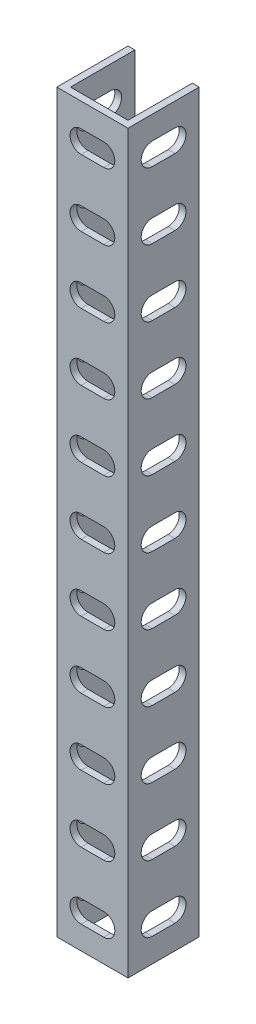
from build123d import *

# Parameters (mm, degrees)
SKETCH1_W           = 13.54
SKETCH1_H           = 140
BOSS_EXTRUDE1_DEPTH = 1.3
SKETCH5_W           = 13.54
SKETCH5_H           = 140
BOSS_EXTRUDE2_DEPTH = 1.3


with BuildPart() as part:
    # Sketch1 → Boss-Extrude1 (new body)
    with BuildSketch(Plane.XY):
        with Locations((0, -63.33)):
            Rectangle(SKETCH1_W, SKETCH1_H)
        with BuildLine():
            Line((-2.15, 2.11), (2.15, 2.11))
            ThreePointArc((2.15, 2.11), (4.26, 0), (2.15, -2.11))
            Line((2.15, -2.11), (-2.15, -2.11))
            ThreePointArc((-2.15, -2.11), (-4.26, 0), (-2.15, 2.11))
        make_face(mode=Mode.SUBTRACT)
        with BuildLine():
            Line((-2.15, -10.57), (2.15, -10.57))
            ThreePointArc((2.15, -10.57), (4.26, -12.68), (2.15, -14.79))
            Line((2.15, -14.79), (-2.15, -14.79))
            ThreePointArc((-2.15, -14.79), (-4.26, -12.68), (-2.15, -10.57))
        make_face(mode=Mode.SUBTRACT)
        with BuildLine():
            Line((-2.15, -23.25), (2.15, -23.25))
            ThreePointArc((2.15, -23.25), (4.26, -25.36), (2.15, -27.47))
            Line((2.15, -27.47), (-2.15, -27.47))
            ThreePointArc((-2.15, -27.47), (-4.26, -25.36), (-2.15, -23.25))
        make_face(mode=Mode.SUBTRACT)
        with BuildLine():
            Line((-2.15, -35.93), (2.15, -35.93))
            ThreePointArc((2.15, -35.93), (4.26, -38.04), (2.15, -40.15))
            Line((2.15, -40.15), (-2.15, -40.15))
            ThreePointArc((-2.15, -40.15), (-4.26, -38.04), (-2.15, -35.93))
        make_face(mode=Mode.SUBTRACT)
        with BuildLine():
            Line((-2.15, -48.61), (2.15, -48.61))
            ThreePointArc((2.15, -48.61), (4.26, -50.72), (2.15, -52.83))
            Line((2.15, -52.83), (-2.15, -52.83))
            ThreePointArc((-2.15, -52.83), (-4.26, -50.72), (-2.15, -48.61))
        make_face(mode=Mode.SUBTRACT)
        with BuildLine():
            Line((-2.15, -61.29), (2.15, -61.29))
            ThreePointArc((2.15, -61.29), (4.26, -63.4), (2.15, -65.51))
            Line((2.15, -65.51), (-2.15, -65.51))
            ThreePointArc((-2.15, -65.51), (-4.26, -63.4), (-2.15, -61.29))
        make_face(mode=Mode.SUBTRACT)
        with BuildLine():
            Line((-2.15, -73.97), (2.15, -73.97))
            ThreePointArc((2.15, -73.97), (4.26, -76.08), (2.15, -78.19))
            Line((2.15, -78.19), (-2.15, -78.19))
            ThreePointArc((-2.15, -78.19), (-4.26, -76.08), (-2.15, -73.97))
        make_face(mode=Mode.SUBTRACT)
        with BuildLine():
            Line((-2.15, -86.65), (2.15, -86.65))
            ThreePointArc((2.15, -86.65), (4.26, -88.76), (2.15, -90.87))
            Line((2.15, -90.87), (-2.15, -90.87))
            ThreePointArc((-2.15, -90.87), (-4.26, -88.76), (-2.15, -86.65))
        make_face(mode=Mode.SUBTRACT)
        with BuildLine():
            Line((-2.15, -99.33), (2.15, -99.33))
            ThreePointArc((2.15, -99.33), (4.26, -101.44), (2.15, -103.55))
            Line((2.15, -103.55), (-2.15, -103.55))
            ThreePointArc((-2.15, -103.55), (-4.26, -101.44), (-2.15, -99.33))
        make_face(mode=Mode.SUBTRACT)
        with BuildLine():
            Line((-2.15, -112.01), (2.15, -112.01))
            ThreePointArc((2.15, -112.01), (4.26, -114.12), (2.15, -116.23))
            Line((2.15, -116.23), (-2.15, -116.23))
            ThreePointArc((-2.15, -116.23), (-4.26, -114.12), (-2.15, -112.01))
        make_face(mode=Mode.SUBTRACT)
        with BuildLine():
            Line((-2.15, -124.69), (2.15, -124.69))
            ThreePointArc((2.15, -124.69), (4.26, -126.8), (2.15, -128.91))
            Line((2.15, -128.91), (-2.15, -128.91))
            ThreePointArc((-2.15, -128.91), (-4.26, -126.8), (-2.15, -124.69))
        make_face(mode=Mode.SUBTRACT)
    extrude(amount=-BOSS_EXTRUDE1_DEPTH)

    # Sketch5 → Boss-Extrude2 (add)
    with BuildSketch(Plane(origin=(6.77, 0, 0), x_dir=(0, 0, -1), z_dir=(1, 0, 0))):
        with Locations((6.77, -63.33)):
            Rectangle(SKETCH5_W, SKETCH5_H)
        with BuildLine():
            Line((4.62, 2.25), (8.92, 2.25))
            ThreePointArc((8.92, 2.25), (11.03, 0.14), (8.92, -1.97))
            Line((8.92, -1.97), (4.62, -1.97))
            ThreePointArc((4.62, -1.97), (2.51, 0.14), (4.62, 2.25))
        make_face(mode=Mode.SUBTRACT)
        with BuildLine():
            Line((4.62, -10.43), (8.92, -10.43))
            ThreePointArc((8.92, -10.43), (11.03, -12.54), (8.92, -14.65))
            Line((8.92, -14.65), (4.62, -14.65))
            ThreePointArc((4.62, -14.65), (2.51, -12.54), (4.62, -10.43))
        make_face(mode=Mode.SUBTRACT)
        with BuildLine():
            Line((4.62, -23.11), (8.92, -23.11))
            ThreePointArc((8.92, -23.11), (11.03, -25.22), (8.92, -27.33))
            Line((8.92, -27.33), (4.62, -27.33))
            ThreePointArc((4.62, -27.33), (2.51, -25.22), (4.62, -23.11))
        make_face(mode=Mode.SUBTRACT)
        with BuildLine():
            Line((4.62, -35.79), (8.92, -35.79))
            ThreePointArc((8.92, -35.79), (11.03, -37.9), (8.92, -40.01))
            Line((8.92, -40.01), (4.62, -40.01))
            ThreePointArc((4.62, -40.01), (2.51, -37.9), (4.62, -35.79))
        make_face(mode=Mode.SUBTRACT)
        with BuildLine():
            Line((4.62, -48.47), (8.92, -48.47))
            ThreePointArc((8.92, -48.47), (11.03, -50.58), (8.92, -52.69))
            Line((8.92, -52.69), (4.62, -52.69))
            ThreePointArc((4.62, -52.69), (2.51, -50.58), (4.62, -48.47))
        make_face(mode=Mode.SUBTRACT)
        with BuildLine():
            Line((4.62, -61.15), (8.92, -61.15))
            ThreePointArc((8.92, -61.15), (11.03, -63.26), (8.92, -65.37))
            Line((8.92, -65.37), (4.62, -65.37))
            ThreePointArc((4.62, -65.37), (2.51, -63.26), (4.62, -61.15))
        make_face(mode=Mode.SUBTRACT)
        with BuildLine():
            Line((4.62, -73.83), (8.92, -73.83))
            ThreePointArc((8.92, -73.83), (11.03, -75.94), (8.92, -78.05))
            Line((8.92, -78.05), (4.62, -78.05))
            ThreePointArc((4.62, -78.05), (2.51, -75.94), (4.62, -73.83))
        make_face(mode=Mode.SUBTRACT)
        with BuildLine():
            Line((4.62, -86.51), (8.92, -86.51))
            ThreePointArc((8.92, -86.51), (11.03, -88.62), (8.92, -90.73))
            Line((8.92, -90.73), (4.62, -90.73))
            ThreePointArc((4.62, -90.73), (2.51, -88.62), (4.62, -86.51))
        make_face(mode=Mode.SUBTRACT)
        with BuildLine():
            Line((4.62, -99.19), (8.92, -99.19))
            ThreePointArc((8.92, -99.19), (11.03, -101.3), (8.92, -103.41))
            Line((8.92, -103.41), (4.62, -103.41))
            ThreePointArc((4.62, -103.41), (2.51, -101.3), (4.62, -99.19))
        make_face(mode=Mode.SUBTRACT)
        with BuildLine():
            Line((4.62, -111.87), (8.92, -111.87))
            ThreePointArc((8.92, -111.87), (11.03, -113.98), (8.92, -116.09))
            Line((8.92, -116.09), (4.62, -116.09))
            ThreePointArc((4.62, -116.09), (2.51, -113.98), (4.62, -111.87))
        make_face(mode=Mode.SUBTRACT)
        with BuildLine():
            Line((4.62, -124.55), (8.92, -124.55))
            ThreePointArc((8.92, -124.55), (11.03, -126.66), (8.92, -128.77))
            Line((8.92, -128.77), (4.62, -128.77))
            ThreePointArc((4.62, -128.77), (2.51, -126.66), (4.62, -124.55))
        make_face(mode=Mode.SUBTRACT)
    boss_extrude2 = extrude(amount=-BOSS_EXTRUDE2_DEPTH)

    # Mirror1: Boss-Extrude2 across plane
    add(boss_extrude2.mirror(Plane(origin=(0, 0, 0), x_dir=(0, 0, 1), z_dir=(1, 0, 0))))


solid = part.part
